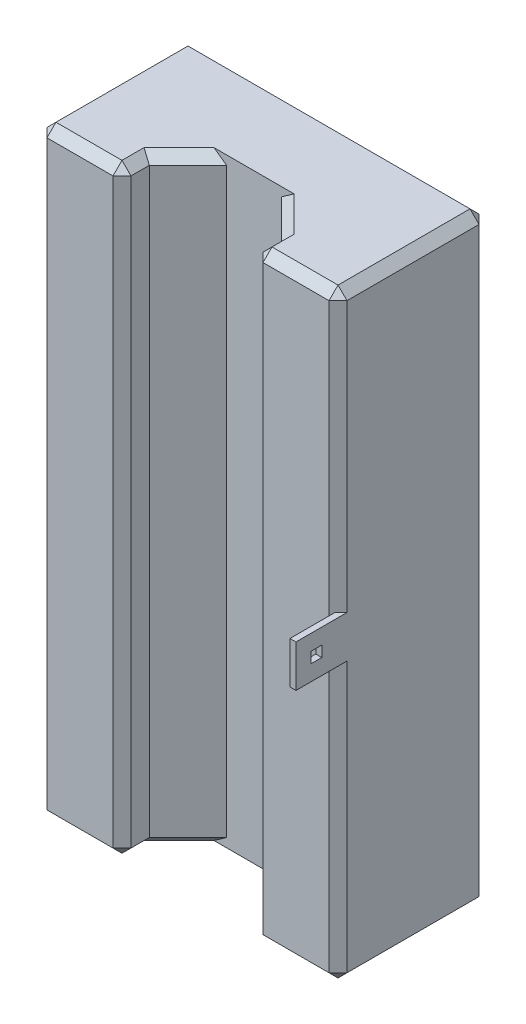
from build123d import *

# Parameters (mm, degrees)
SKETCH1_W                = 50
SKETCH1_H                = 100
BOSS_EXTRUDE1_DEPTH      = 25
CUT_EXTRUDE1_DEPTH       = 115.564392374
CHAMFER1_SIZE            = 1.5
BOSS_EXTRUDE2_DEPTH      = 7
BOSS_EXTRUDE2_DEPTH_BACK = 10
SKETCH3_W                = 1
SKETCH3_H                = 7
SKETCH4_W                = 1.8
SKETCH4_H                = 1.8
CUT_EXTRUDE2_DEPTH       = 7


with BuildPart() as part:
    # Sketch1 → Boss-Extrude1 (new body)
    with BuildSketch(Plane.XY):
        with Locations((25, 50)):
            Rectangle(SKETCH1_W, SKETCH1_H)
    extrude(amount=BOSS_EXTRUDE1_DEPTH)

    # Sketch2 → Cut-Extrude1 (cut, through all)
    with BuildSketch(Plane.XZ):
        Polygon((29.556349186, 36), (20.443650814, 36), (14, 29.556349186), (14, 20.443650814), (20.443650814, 14), (29.556349186, 14), (36, 20.443650814), (36, 29.556349186), align=None)
    extrude(amount=-CUT_EXTRUDE1_DEPTH, mode=Mode.SUBTRACT)

    # Chamfer1
    chamfer1_edges = [part.edges().sort_by_distance(p)[0] for p in [
        (50, 50, 25),
        (43, 100, 25),
        (43, 0, 25),
        (7, 100, 25),
        (14, 50, 25),
        (36, 50, 25),
        (36, 100, 22.721825407),
        (14, 100, 22.721825407),
        (36, 0, 22.721825407),
        (14, 0, 22.721825407),
        (17.221825407, 0, 17.221825407),
        (32.778174593, 0, 17.221825407),
        (32.778174593, 100, 17.221825407),
        (17.221825407, 100, 17.221825407),
        (0, 50, 25),
        (25, 100, 0),
        (50, 50, 0),
        (25, 0, 0),
        (0, 50, 0),
        (7, 0, 25),
        (0, 100, 12.5),
        (50, 100, 12.5),
        (50, 0, 12.5),
        (0, 0, 12.5),
    ]]
    chamfer(chamfer1_edges, length=CHAMFER1_SIZE)

    # Sketch3 → Boss-Extrude2 (add, two sides: drawn at the far end of the back side and taken through both)
    with BuildSketch(Plane.XY.offset(25).offset(-BOSS_EXTRUDE2_DEPTH_BACK)):
        with Locations((49.5, 50)):
            Rectangle(SKETCH3_W, SKETCH3_H)
    extrude(amount=BOSS_EXTRUDE2_DEPTH + BOSS_EXTRUDE2_DEPTH_BACK)

    # Sketch4 → Cut-Extrude2 (cut)
    with BuildSketch(Plane(origin=(50, 0, 0), x_dir=(0, 0, -1), z_dir=(1, 0, 0))):
        with Locations((-28.6, 50)):
            Rectangle(SKETCH4_W, SKETCH4_H)
    extrude(amount=-CUT_EXTRUDE2_DEPTH, mode=Mode.SUBTRACT)


solid = part.part
